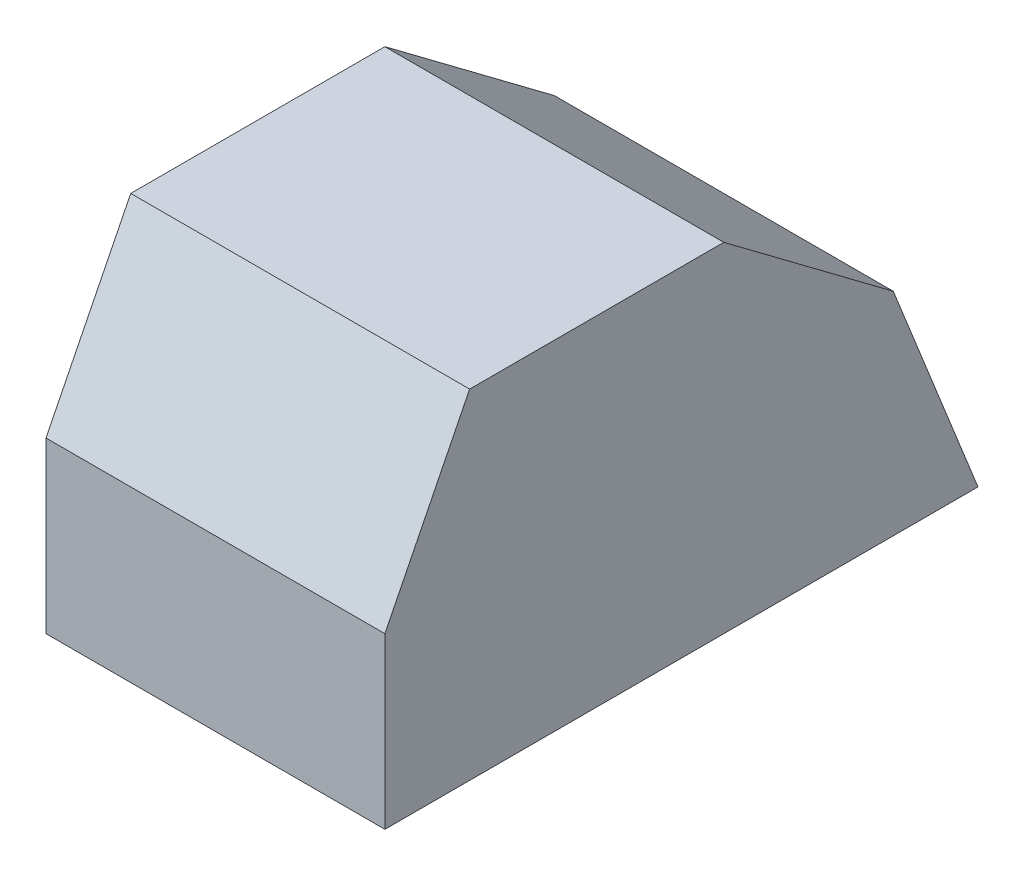
from build123d import *

# Parameters (mm, degrees)
BOSS_EXTRUDE1_DEPTH = 40


with BuildPart() as part:
    # Sketch1 → Boss-Extrude1 (new body)
    with BuildSketch(Plane(origin=(0, 0, 0), x_dir=(0, 0, -1), z_dir=(1, 0, 0))):
        Polygon((0, 0), (70, 0), (60, 25), (40, 40), (10, 40), (0, 20), align=None)
    extrude(amount=BOSS_EXTRUDE1_DEPTH)


solid = part.part
